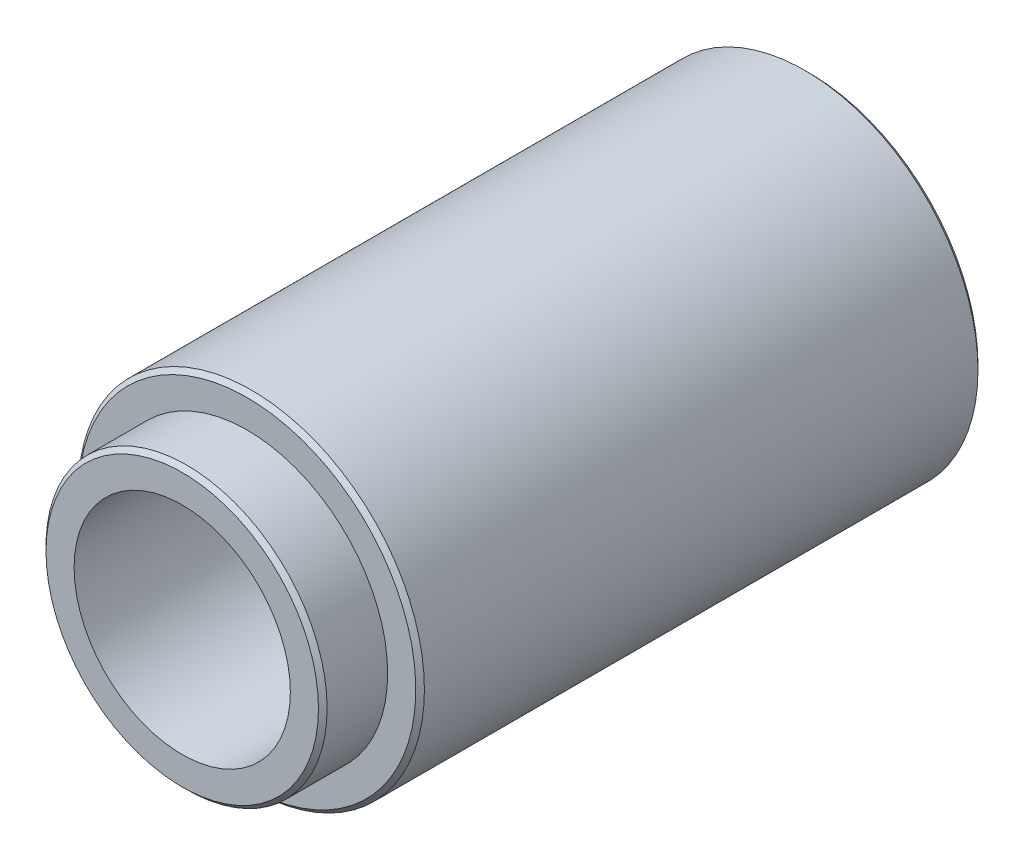
from build123d import *

# Parameters (mm, degrees)
SKIZZE1_R                            = 8
AUFSATZ_LINEAR_AUSTRAGEN1_DEPTH      = 26
SKIZZE2_R                            = 6.5
AUFSATZ_LINEAR_AUSTRAGEN2_DEPTH      = 3
SCHNITT_LINEAR_AUSTRAGEN1_DEPTH      = 32.128764833
SCHNITT_LINEAR_AUSTRAGEN1_DEPTH_BACK = 32.128764833
SKIZZE3_R                            = 5
FASE1_SIZE                           = 0.2


with BuildPart() as part:
    # Skizze1 → Aufsatz-Linear austragen1 (new body)
    with BuildSketch(Plane.XY):
        with Locations(Location((0, 0, 0), (0, 0, 180))):
            Circle(SKIZZE1_R)
    extrude(amount=AUFSATZ_LINEAR_AUSTRAGEN1_DEPTH)

    # Skizze2 → Aufsatz-Linear austragen2 (add)
    with BuildSketch(Plane.XY.offset(26)):
        Circle(SKIZZE2_R)
    extrude(amount=AUFSATZ_LINEAR_AUSTRAGEN2_DEPTH)

    # Skizze3 → Schnitt-Linear austragen1 (cut, two sides: drawn at the far end of the back side and taken through both)
    with BuildSketch(Plane(origin=(0, 0, 0), x_dir=(-1, 0, 0), z_dir=(0, 0, -1)).offset(-SCHNITT_LINEAR_AUSTRAGEN1_DEPTH_BACK)):
        Circle(SKIZZE3_R)
    extrude(amount=SCHNITT_LINEAR_AUSTRAGEN1_DEPTH + SCHNITT_LINEAR_AUSTRAGEN1_DEPTH_BACK, mode=Mode.SUBTRACT)

    # Fase1
    fase1_edges = [part.edges().sort_by_distance(p)[0] for p in [
        (8, 0, 0),
        (8, 0, 26),
        (-6.5, 0, 29),
    ]]
    chamfer(fase1_edges, length=FASE1_SIZE)


solid = part.part
